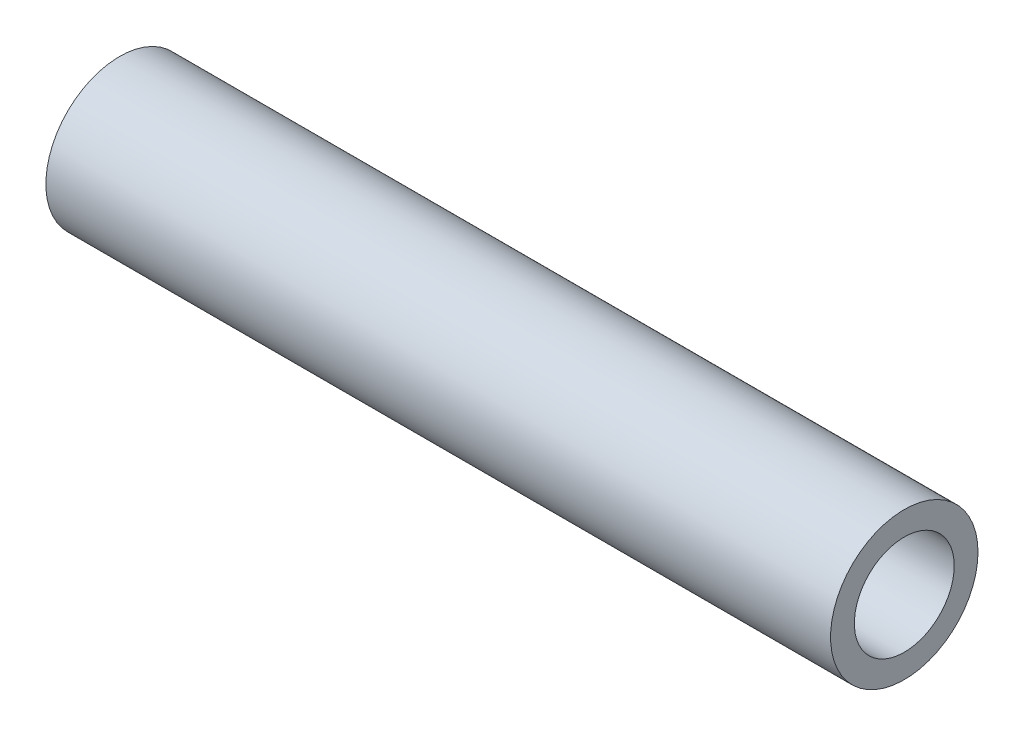
from build123d import *

# Parameters (mm, degrees)
IZIM1_R                     = 3.1
IZIM1_R_2                   = 2.1
Y_KSEKLIK_EKSTR_ZYON1_DEPTH = 33


with BuildPart() as part:
    # Çizim1 → Yükseklik-Ekstrüzyon1 (new body)
    with BuildSketch(Plane.YZ):
        with Locations(Location((0, 0, 0), (0, 0, 270))):
            Circle(IZIM1_R)
        with Locations(Location((0, 0, 0), (0, 0, 270))):
            Circle(IZIM1_R_2, mode=Mode.SUBTRACT)
    extrude(amount=Y_KSEKLIK_EKSTR_ZYON1_DEPTH)


solid = part.part
